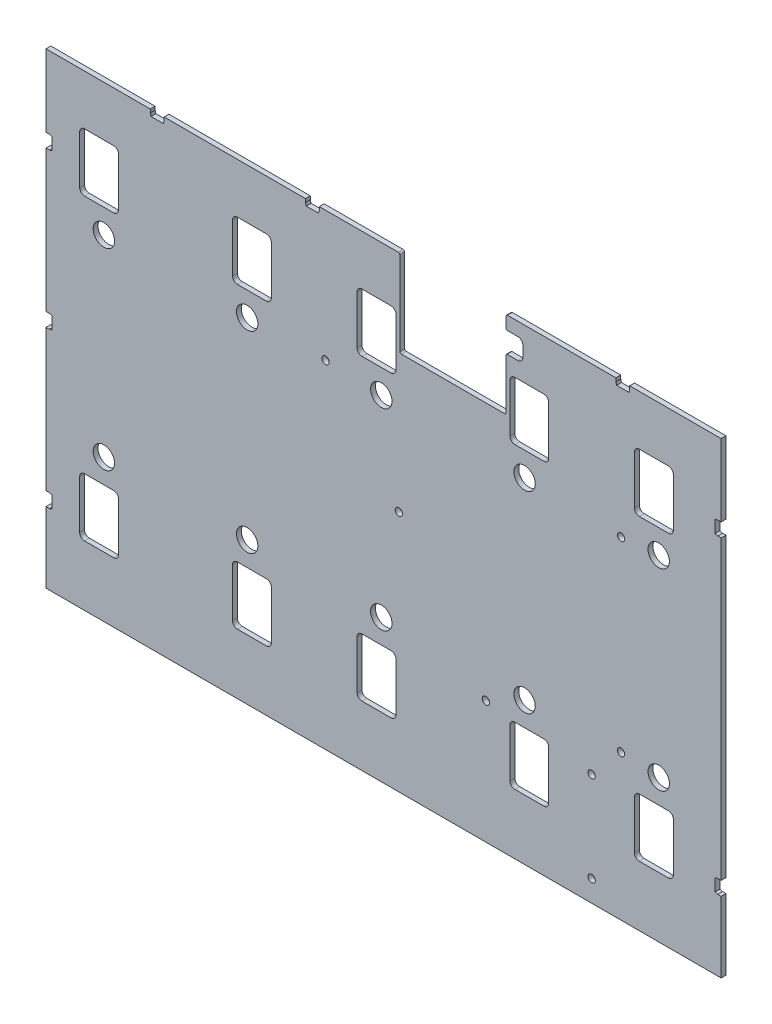
from build123d import *

# Parameters (mm, degrees)
SKETCH1_W            = 441.979400076
SKETCH1_H            = 305.81676
BOSS_EXTRUDE1_DEPTH  = 3.175
CUT_EXTRUDE1_DEPTH   = 271.654843319
CUT_EXTRUDE2_DEPTH   = 271.654843319
LPATTERN1_COUNT      = 3
LPATTERN1_PITCH      = 181.613999992
LPATTERN2_COUNT      = 2
LPATTERN2_PITCH      = 181.613999992
CUT_EXTRUDE3_DEPTH   = 271.654843319
SKETCH5_R            = 7
CUT_EXTRUDE4_DEPTH   = 271.654843319
M4_CLEARANCE_HOLE1_D = 4.8
FILLET1_R            = 1
CUT_EXTRUDE5_DEPTH   = 271.654843319


with BuildPart() as part:
    # Sketch1 → Boss-Extrude1 (new body)
    with BuildSketch(Plane.XY):
        with Locations((0, -3.32067)):
            Rectangle(SKETCH1_W, SKETCH1_H)
    extrude(amount=BOSS_EXTRUDE1_DEPTH)

    # Sketch2 → Cut-Extrude1 (cut, through all)
    with BuildSketch(Plane.XY.offset(3.175)):
        with BuildLine():
            Line((-195.7605, 116.8), (-176.7105, 116.8))
            ThreePointArc((-176.7105, 116.8), (-174.46543597, 115.87006403), (-173.5355, 113.625))
            Line((-173.5355, 113.625), (-173.5355, 81.875))
            ThreePointArc((-173.5355, 81.875), (-174.46543597, 79.62993597), (-176.7105, 78.7))
            Line((-176.7105, 78.7), (-195.7605, 78.7))
            ThreePointArc((-195.7605, 78.7), (-198.00556403, 79.62993597), (-198.9355, 81.875))
            Line((-198.9355, 81.875), (-198.9355, 113.625))
            ThreePointArc((-198.9355, 113.625), (-198.00556403, 115.87006403), (-195.7605, 116.8))
        make_face()
        with BuildLine():
            Line((-195.7605, -78.7), (-176.7105, -78.7))
            ThreePointArc((-176.7105, -78.7), (-174.46543597, -79.62993597), (-173.5355, -81.875))
            Line((-173.5355, -81.875), (-173.5355, -113.625))
            ThreePointArc((-173.5355, -113.625), (-174.46543597, -115.87006403), (-176.7105, -116.8))
            Line((-176.7105, -116.8), (-195.7605, -116.8))
            ThreePointArc((-195.7605, -116.8), (-198.00556403, -115.87006403), (-198.9355, -113.625))
            Line((-198.9355, -113.625), (-198.9355, -81.875))
            ThreePointArc((-198.9355, -81.875), (-198.00556403, -79.62993597), (-195.7605, -78.7))
        make_face()
    cut_extrude1 = extrude(amount=-CUT_EXTRUDE1_DEPTH, mode=Mode.SUBTRACT)

    # Sketch3 → Cut-Extrude2 (cut, through all)
    with BuildSketch(Plane.XY.offset(3.175)):
        with BuildLine():
            Line((-76.6655, 116.8), (-95.7155, 116.8))
            ThreePointArc((-95.7155, 116.8), (-97.96056403, 115.87006403), (-98.8905, 113.625))
            Line((-98.8905, 113.625), (-98.8905, 81.875))
            ThreePointArc((-98.8905, 81.875), (-97.96056403, 79.62993597), (-95.7155, 78.7))
            Line((-95.7155, 78.7), (-76.6655, 78.7))
            ThreePointArc((-76.6655, 78.7), (-74.42043597, 79.62993597), (-73.4905, 81.875))
            Line((-73.4905, 81.875), (-73.4905, 113.625))
            ThreePointArc((-73.4905, 113.625), (-74.42043597, 115.87006403), (-76.6655, 116.8))
        make_face()
        with BuildLine():
            Line((-95.7155, -116.8), (-76.6655, -116.8))
            ThreePointArc((-76.6655, -116.8), (-74.42043597, -115.87006403), (-73.4905, -113.625))
            Line((-73.4905, -113.625), (-73.4905, -81.875))
            ThreePointArc((-73.4905, -81.875), (-74.42043597, -79.62993597), (-76.6655, -78.7))
            Line((-76.6655, -78.7), (-95.7155, -78.7))
            ThreePointArc((-95.7155, -78.7), (-97.96056403, -79.62993597), (-98.8905, -81.875))
            Line((-98.8905, -81.875), (-98.8905, -113.625))
            ThreePointArc((-98.8905, -113.625), (-97.96056403, -115.87006403), (-95.7155, -116.8))
        make_face()
    cut_extrude2 = extrude(amount=-CUT_EXTRUDE2_DEPTH, mode=Mode.SUBTRACT)

    # LPattern1: Cut-Extrude1 ×3
    with Locations(*[(i * LPATTERN1_PITCH, 0, 0) for i in range(1, LPATTERN1_COUNT)]):
        add(cut_extrude1, mode=Mode.SUBTRACT)

    # LPattern2: Cut-Extrude2 ×2
    with Locations(*[(i * LPATTERN2_PITCH, 0, 0) for i in range(1, LPATTERN2_COUNT)]):
        add(cut_extrude2, mode=Mode.SUBTRACT)

    # Sketch4 → Cut-Extrude3 (cut, through all)
    with BuildSketch(Plane.XY.offset(3.175)):
        with BuildLine():
            Line((10.630999992, 149.58771), (10.630999992, 92.81771))
            Line((10.630999992, 92.81771), (80.170999992, 92.81771))
            Line((80.170999992, 92.81771), (80.170999992, 126.58771))
            ThreePointArc((80.170999992, 126.58771), (80.384812042, 127.10389795), (80.900999992, 127.31771))
            Line((80.900999992, 127.31771), (87.900999992, 127.31771))
            ThreePointArc((87.900999992, 127.31771), (90.213239166, 128.275470826), (91.170999992, 130.58771))
            Line((91.170999992, 130.58771), (91.170999992, 137.58771))
            ThreePointArc((91.170999992, 137.58771), (90.213239166, 139.899949174), (87.900999992, 140.85771))
            Line((87.900999992, 140.85771), (80.900999992, 140.85771))
            ThreePointArc((80.900999992, 140.85771), (80.384812042, 141.07152205), (80.170999992, 141.58771))
            Line((80.170999992, 141.58771), (80.170999992, 149.58771))
            Line((80.170999992, 149.58771), (10.630999992, 149.58771))
        make_face()
    extrude(amount=-CUT_EXTRUDE3_DEPTH, mode=Mode.SUBTRACT)

    # Sketch5 → Cut-Extrude4 (cut, through all)
    with BuildSketch(Plane.XY.offset(3.175)):
        with Locations((-183.117651533, 63.008899223)):
            Circle(SKETCH5_R)
        with Locations((-183.117651533, -63.008899223)):
            Circle(SKETCH5_R)
        with Locations((-89.308348443, -63.008899223)):
            Circle(SKETCH5_R)
        with Locations((-89.308348443, 63.008899223)):
            Circle(SKETCH5_R)
        with Locations((180.110348451, -63.008899223)):
            Circle(SKETCH5_R)
        with Locations((180.110348451, 63.008899223)):
            Circle(SKETCH5_R)
        with Locations((92.305651549, 63.008899223)):
            Circle(SKETCH5_R)
        with Locations((92.305651549, -63.008899223)):
            Circle(SKETCH5_R)
        with Locations((-1.503651541, -63.008899223)):
            Circle(SKETCH5_R)
        with Locations((-1.503651541, 63.008899223)):
            Circle(SKETCH5_R)
    extrude(amount=-CUT_EXTRUDE4_DEPTH, mode=Mode.SUBTRACT)

    # M4 Clearance Hole1 (through all)
    with Locations(Plane.XY.offset(3.175)):
        with Locations((-38.010299962, 64.5), (9.989700038, 2.5), (66.989700038, -76), (136.207999988, -142.21600002), (136.207999988, -83.21600002), (155.489700038, -61), (155.489700038, 61)):
            Hole(M4_CLEARANCE_HOLE1_D / 2)

    # Fillet1
    fillet1_edges = [part.edges().sort_by_distance(p)[0] for p in [
        (80.170999992, 92.81771, 1.5875),
        (10.630999992, 92.81771, 1.5875),
        (10.630999992, 149.58771, 1.5875),
        (80.170999992, 149.58771, 1.5875),
    ]]
    fillet(fillet1_edges, radius=FILLET1_R)

    # Sketch8 → Cut-Extrude5 (cut, through all)
    with BuildSketch(Plane.XY.offset(3.175)):
        with BuildLine():
            Line((223.754700038, 93.083202416), (223.754700038, 92.526512865))
            Line((223.754700038, 92.526512865), (220.989700038, 92.526512865))
            Line((220.989700038, 92.526512865), (220.989700038, 93.26595))
            Line((220.989700038, 93.26595), (218.73804754, 93.26595))
            Line((218.73804754, 93.26595), (216.989700038, 93.734418301))
            Line((216.989700038, 93.734418301), (216.989700038, 101.807481699))
            Line((216.989700038, 101.807481699), (218.73804754, 102.27595))
            Line((218.73804754, 102.27595), (220.989700038, 102.27595))
            Line((220.989700038, 102.27595), (220.989700038, 103.015387135))
            Line((220.989700038, 103.015387135), (223.754700038, 103.015387135))
            Line((223.754700038, 103.015387135), (223.754700038, 102.458697584))
            ThreePointArc((223.754700038, 102.458697584), (224.308097472, 102.059602449), (224.519700038, 101.41095))
            Line((224.519700038, 101.41095), (224.519700038, 94.13095))
            ThreePointArc((224.519700038, 94.13095), (224.308097472, 93.482297551), (223.754700038, 93.083202416))
        make_face()
        with BuildLine():
            Line((-224.519700038, 94.13095), (-224.519700038, 101.41095))
            ThreePointArc((-224.519700038, 101.41095), (-224.308097472, 102.059602449), (-223.754700038, 102.458697584))
            Line((-223.754700038, 102.458697584), (-223.754700038, 103.015387135))
            Line((-223.754700038, 103.015387135), (-220.989700038, 103.015387135))
            Line((-220.989700038, 103.015387135), (-220.989700038, 102.27595))
            Line((-220.989700038, 102.27595), (-218.73804754, 102.27595))
            Line((-218.73804754, 102.27595), (-216.989700038, 101.807481699))
            Line((-216.989700038, 101.807481699), (-216.989700038, 93.734418301))
            Line((-216.989700038, 93.734418301), (-218.73804754, 93.26595))
            Line((-218.73804754, 93.26595), (-220.989700038, 93.26595))
            Line((-220.989700038, 93.26595), (-220.989700038, 92.526512865))
            Line((-220.989700038, 92.526512865), (-223.754700038, 92.526512865))
            Line((-223.754700038, 92.526512865), (-223.754700038, 93.083202416))
            ThreePointArc((-223.754700038, 93.083202416), (-224.308097472, 93.482297551), (-224.519700038, 94.13095))
        make_face()
        with BuildLine():
            Line((224.519700038, -101.78905), (224.519700038, -109.06905))
            ThreePointArc((224.519700038, -109.06905), (224.308097472, -109.717702449), (223.754700038, -110.116797584))
            Line((223.754700038, -110.116797584), (223.754700038, -110.658869179))
            Line((223.754700038, -110.658869179), (220.989700038, -110.658869179))
            Line((220.989700038, -110.658869179), (220.989700038, -109.93405))
            Line((220.989700038, -109.93405), (218.73804754, -109.93405))
            Line((218.73804754, -109.93405), (216.989700038, -109.465581699))
            Line((216.989700038, -109.465581699), (216.989700038, -101.392518301))
            Line((216.989700038, -101.392518301), (218.73804754, -100.92405))
            Line((218.73804754, -100.92405), (220.989700038, -100.92405))
            Line((220.989700038, -100.92405), (220.989700038, -100.199230821))
            Line((220.989700038, -100.199230821), (223.754700038, -100.199230821))
            Line((223.754700038, -100.199230821), (223.754700038, -100.741302416))
            ThreePointArc((223.754700038, -100.741302416), (224.308097472, -101.140397551), (224.519700038, -101.78905))
        make_face()
        with BuildLine():
            Line((-223.754700038, 0.858697584), (-223.754700038, 1.400769179))
            Line((-223.754700038, 1.400769179), (-220.989700038, 1.400769179))
            Line((-220.989700038, 1.400769179), (-220.989700038, 0.67595))
            Line((-220.989700038, 0.67595), (-218.73804754, 0.67595))
            Line((-218.73804754, 0.67595), (-216.989700038, 0.207481699))
            Line((-216.989700038, 0.207481699), (-216.989700038, -7.865581699))
            Line((-216.989700038, -7.865581699), (-218.73804754, -8.33405))
            Line((-218.73804754, -8.33405), (-220.989700038, -8.33405))
            Line((-220.989700038, -8.33405), (-220.989700038, -9.058869179))
            Line((-220.989700038, -9.058869179), (-223.754700038, -9.058869179))
            Line((-223.754700038, -9.058869179), (-223.754700038, -8.516797584))
            ThreePointArc((-223.754700038, -8.516797584), (-224.308097472, -8.117702449), (-224.519700038, -7.46905))
            Line((-224.519700038, -7.46905), (-224.519700038, -0.18905))
            ThreePointArc((-224.519700038, -0.18905), (-224.308097472, 0.459602449), (-223.754700038, 0.858697584))
        make_face()
        with BuildLine():
            Line((-223.754700038, -100.741302416), (-223.754700038, -100.199230821))
            Line((-223.754700038, -100.199230821), (-220.989700038, -100.199230821))
            Line((-220.989700038, -100.199230821), (-220.989700038, -100.92405))
            Line((-220.989700038, -100.92405), (-218.73804754, -100.92405))
            Line((-218.73804754, -100.92405), (-216.989700038, -101.392518301))
            Line((-216.989700038, -101.392518301), (-216.989700038, -109.465581699))
            Line((-216.989700038, -109.465581699), (-218.73804754, -109.93405))
            Line((-218.73804754, -109.93405), (-220.989700038, -109.93405))
            Line((-220.989700038, -109.93405), (-220.989700038, -110.658869179))
            Line((-220.989700038, -110.658869179), (-223.754700038, -110.658869179))
            Line((-223.754700038, -110.658869179), (-223.754700038, -110.116797584))
            ThreePointArc((-223.754700038, -110.116797584), (-224.308097472, -109.717702449), (-224.519700038, -109.06905))
            Line((-224.519700038, -109.06905), (-224.519700038, -101.78905))
            ThreePointArc((-224.519700038, -101.78905), (-224.308097472, -101.140397551), (-223.754700038, -100.741302416))
        make_face()
        with BuildLine():
            Line((152.950006743, 153.11771), (160.230006743, 153.11771))
            ThreePointArc((160.230006743, 153.11771), (160.878659192, 152.906107434), (161.277754327, 152.35271))
            Line((161.277754327, 152.35271), (161.83965744, 152.35271))
            Line((161.83965744, 152.35271), (161.83965744, 149.58771))
            Line((161.83965744, 149.58771), (161.095006743, 149.58771))
            Line((161.095006743, 149.58771), (161.095006743, 147.336057502))
            Line((161.095006743, 147.336057502), (160.626538442, 145.58771))
            Line((160.626538442, 145.58771), (158.491670732, 145.58771))
            Line((158.491670732, 145.58771), (158.452461628, 145.58771))
            Line((158.452461628, 145.58771), (158.121947003, 145.58771))
            Line((158.121947003, 145.58771), (155.779944773, 145.58771))
            Line((155.779944773, 145.58771), (155.47410616, 145.58771))
            Line((155.47410616, 145.58771), (155.342804928, 145.58771))
            Line((155.342804928, 145.58771), (153.878280784, 145.58771))
            Line((153.878280784, 145.58771), (153.611651275, 145.58771))
            Line((153.611651275, 145.58771), (152.553475045, 145.58771))
            Line((152.553475045, 145.58771), (152.085006743, 147.336057502))
            Line((152.085006743, 147.336057502), (152.085006743, 149.58771))
            Line((152.085006743, 149.58771), (151.340356046, 149.58771))
            Line((151.340356046, 149.58771), (151.340356046, 152.35271))
            Line((151.340356046, 152.35271), (151.902259159, 152.35271))
            ThreePointArc((151.902259159, 152.35271), (152.301354294, 152.906107434), (152.950006743, 153.11771))
        make_face()
        with BuildLine():
            Line((-50.249993257, 153.11771), (-42.969993257, 153.11771))
            ThreePointArc((-42.969993257, 153.11771), (-42.321340808, 152.906107434), (-41.922245673, 152.35271))
            Line((-41.922245673, 152.35271), (-41.36034256, 152.35271))
            Line((-41.36034256, 152.35271), (-41.36034256, 149.58771))
            Line((-41.36034256, 149.58771), (-42.104993257, 149.58771))
            Line((-42.104993257, 149.58771), (-42.104993257, 147.336057502))
            Line((-42.104993257, 147.336057502), (-42.573461558, 145.58771))
            Line((-42.573461558, 145.58771), (-44.708329268, 145.58771))
            Line((-44.708329268, 145.58771), (-44.747538372, 145.58771))
            Line((-44.747538372, 145.58771), (-45.078052997, 145.58771))
            Line((-45.078052997, 145.58771), (-47.420055227, 145.58771))
            Line((-47.420055227, 145.58771), (-47.72589384, 145.58771))
            Line((-47.72589384, 145.58771), (-47.857195072, 145.58771))
            Line((-47.857195072, 145.58771), (-49.321719216, 145.58771))
            Line((-49.321719216, 145.58771), (-49.588348725, 145.58771))
            Line((-49.588348725, 145.58771), (-50.646524955, 145.58771))
            Line((-50.646524955, 145.58771), (-51.114993257, 147.336057502))
            Line((-51.114993257, 147.336057502), (-51.114993257, 149.58771))
            Line((-51.114993257, 149.58771), (-51.859643954, 149.58771))
            Line((-51.859643954, 149.58771), (-51.859643954, 152.35271))
            Line((-51.859643954, 152.35271), (-51.297740841, 152.35271))
            ThreePointArc((-51.297740841, 152.35271), (-50.898645706, 152.906107434), (-50.249993257, 153.11771))
        make_face()
        with BuildLine():
            Line((-151.849993257, 153.11771), (-144.569993257, 153.11771))
            ThreePointArc((-144.569993257, 153.11771), (-143.921340808, 152.906107434), (-143.522245673, 152.35271))
            Line((-143.522245673, 152.35271), (-142.96034256, 152.35271))
            Line((-142.96034256, 152.35271), (-142.96034256, 149.58771))
            Line((-142.96034256, 149.58771), (-143.704993257, 149.58771))
            Line((-143.704993257, 149.58771), (-143.704993257, 147.336057502))
            Line((-143.704993257, 147.336057502), (-144.173461558, 145.58771))
            Line((-144.173461558, 145.58771), (-146.308329268, 145.58771))
            Line((-146.308329268, 145.58771), (-146.347538372, 145.58771))
            Line((-146.347538372, 145.58771), (-146.678052997, 145.58771))
            Line((-146.678052997, 145.58771), (-149.020055227, 145.58771))
            Line((-149.020055227, 145.58771), (-149.32589384, 145.58771))
            Line((-149.32589384, 145.58771), (-149.457195072, 145.58771))
            Line((-149.457195072, 145.58771), (-150.921719216, 145.58771))
            Line((-150.921719216, 145.58771), (-151.188348725, 145.58771))
            Line((-151.188348725, 145.58771), (-152.246524955, 145.58771))
            Line((-152.246524955, 145.58771), (-152.714993257, 147.336057502))
            Line((-152.714993257, 147.336057502), (-152.714993257, 149.58771))
            Line((-152.714993257, 149.58771), (-153.459643954, 149.58771))
            Line((-153.459643954, 149.58771), (-153.459643954, 152.35271))
            Line((-153.459643954, 152.35271), (-152.897740841, 152.35271))
            ThreePointArc((-152.897740841, 152.35271), (-152.498645706, 152.906107434), (-151.849993257, 153.11771))
        make_face()
    extrude(amount=-CUT_EXTRUDE5_DEPTH, mode=Mode.SUBTRACT)


solid = part.part
